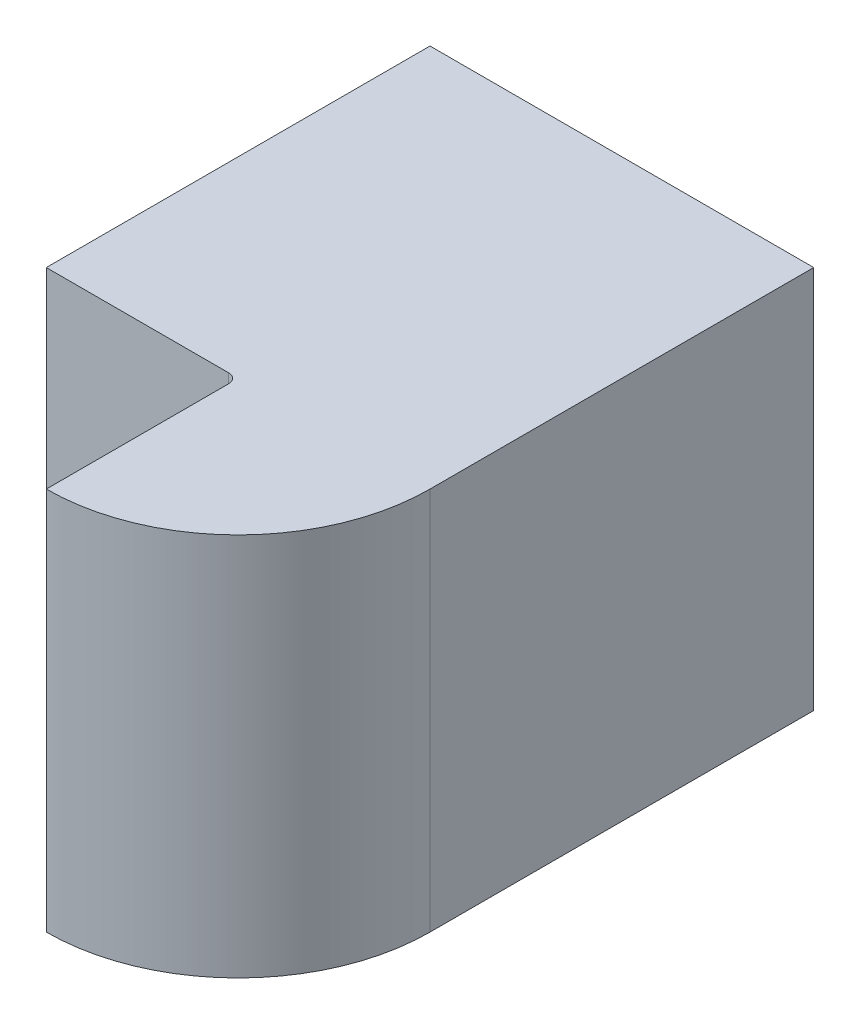
from build123d import *

# Parameters (mm, degrees)
SKETCH1_W           = 101.6
SKETCH1_H           = 101.6
BOSS_EXTRUDE1_DEPTH = 101.6
SKETCH3_W           = 50.8
SKETCH3_H           = 101.6
REVOLVE1_ANGLE      = 90
FILLET1_R           = 2.54


with BuildPart() as part:
    # Sketch1 → Boss-Extrude1 (new body)
    with BuildSketch(Plane(origin=(0, 0, 0), x_dir=(1, 0, 0), z_dir=(0, 1, 0))):
        Rectangle(SKETCH1_W, SKETCH1_H)
    extrude(amount=BOSS_EXTRUDE1_DEPTH)

    # Sketch3 → Revolve1 (revolve)
    with BuildSketch(Plane.XY.offset(50.8)):
        with Locations((25.4, 50.8)):
            Rectangle(SKETCH3_W, SKETCH3_H)
    revolve(axis=Axis((0, 0, 50.8), (0, -1, 0)), revolution_arc=REVOLVE1_ANGLE)

    # Fillet1
    fillet1_edges = [part.edges().sort_by_distance(p)[0] for p in [
        (0, 50.8, 50.8),
    ]]
    fillet(fillet1_edges, radius=FILLET1_R)


solid = part.part
